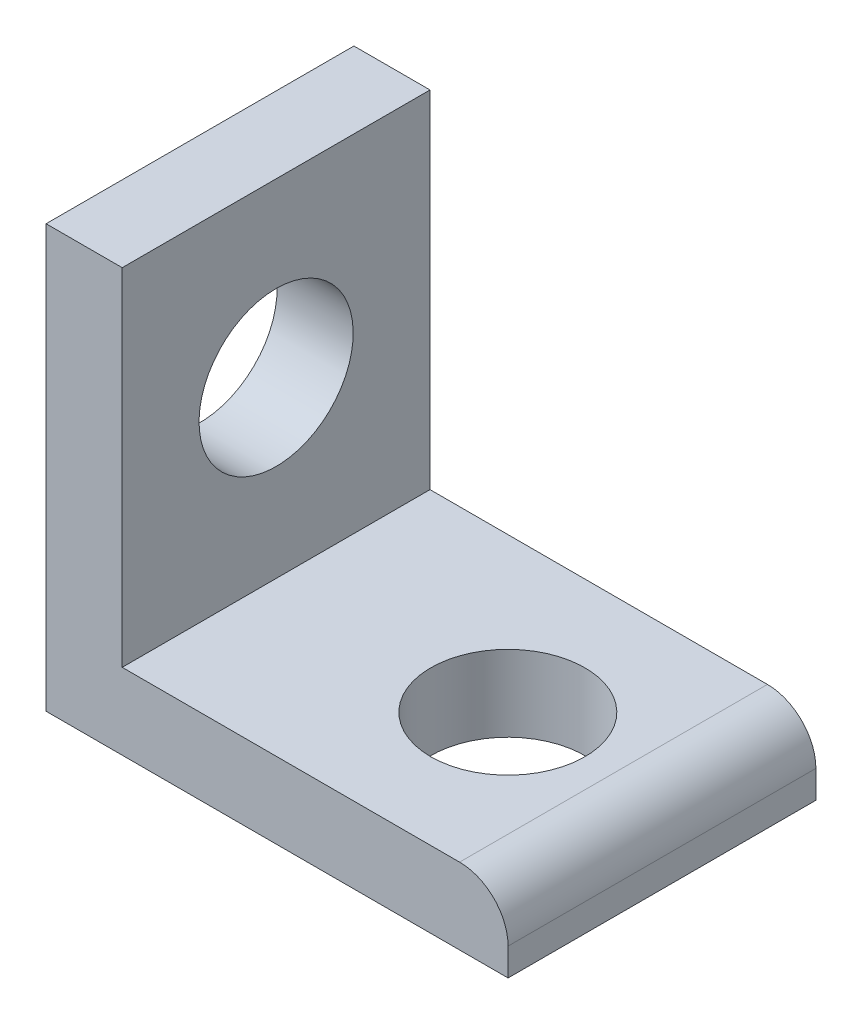
from build123d import *

# Parameters (mm, degrees)
BOSS_EXTRUDE1_DEPTH = 6.35
SKETCH2_R           = 1.59
CUT_EXTRUDE1_DEPTH  = 1.57
SKETCH3_R           = 1.59
CUT_EXTRUDE2_DEPTH  = 1.57
FILLET1_R           = 1


with BuildPart() as part:
    # Sketch1 → Boss-Extrude1 (new body)
    with BuildSketch(Plane.XY):
        Polygon((0, 8.71), (1.57, 8.71), (1.57, 1.57), (9.53, 1.57), (9.53, 0), (0, 0), align=None)
    extrude(amount=BOSS_EXTRUDE1_DEPTH)

    # Sketch2 → Cut-Extrude1 (cut)
    with BuildSketch(Plane(origin=(0, 1.57, 0), x_dir=(1, 0, 0), z_dir=(0, 1, 0))):
        with Locations(Location((6.35, -3.175, 0), (0, 0, 270))):
            Circle(SKETCH2_R)
    extrude(amount=-CUT_EXTRUDE1_DEPTH, mode=Mode.SUBTRACT)

    # Sketch3 → Cut-Extrude2 (cut)
    with BuildSketch(Plane(origin=(1.57, 0, 0), x_dir=(0, 0, -1), z_dir=(1, 0, 0))):
        with Locations(Location((-3.175, 5.16, 0), (0, 0, 90))):
            Circle(SKETCH3_R)
    extrude(amount=-CUT_EXTRUDE2_DEPTH, mode=Mode.SUBTRACT)

    # Fillet1
    fillet1_edges = [part.edges().sort_by_distance(p)[0] for p in [
        (9.53, 1.57, 3.175),
    ]]
    fillet(fillet1_edges, radius=FILLET1_R)


solid = part.part
